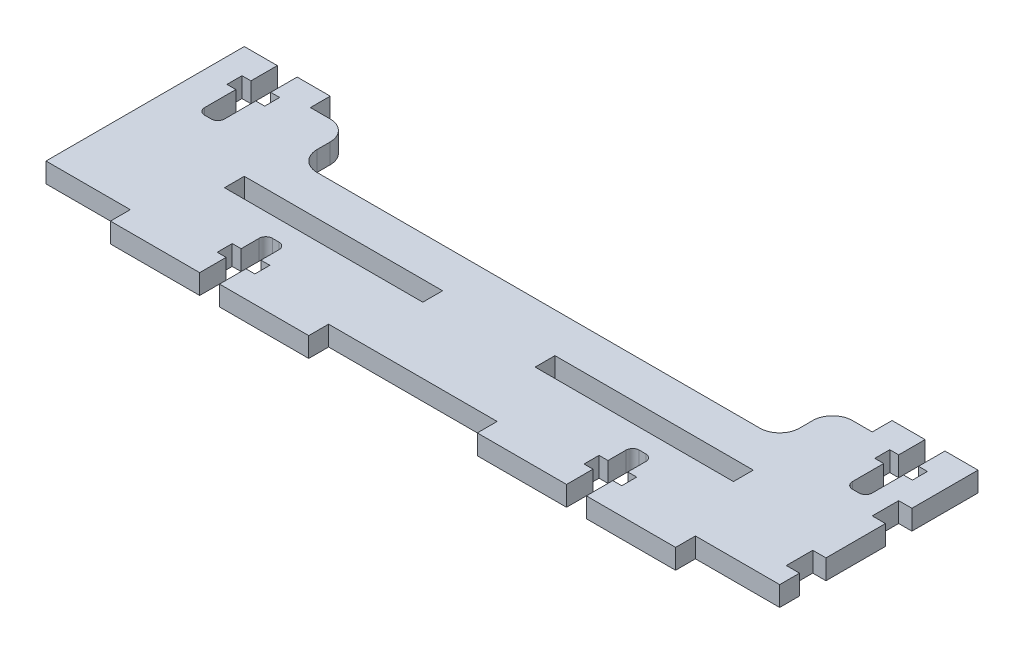
from build123d import *

# Parameters (mm, degrees)
SKETCH1_W               = 111
SKETCH1_H               = 30
BOSS_EXTRUDE1_DEPTH     = 1.5
SKETCH2_W               = 30
SKETCH2_H               = 3
BOSS_EXTRUDE2_DEPTH     = 1.5
CUT_EXTRUDE2_DEPTH      = 59.365229375
CUT_EXTRUDE2_DEPTH_BACK = 59.365229375
CUT_EXTRUDE3_DEPTH      = 59.365229375
CUT_EXTRUDE3_DEPTH_BACK = 59.365229375
SKETCH6_W               = 2
SKETCH6_H               = 4
CUT_EXTRUDE4_DEPTH      = 59.423026282
CUT_EXTRUDE4_DEPTH_BACK = 59.423026282
SKETCH7_W               = 30
SKETCH7_H               = 3
CUT_EXTRUDE5_DEPTH      = 59.365229375
CUT_EXTRUDE5_DEPTH_BACK = 59.365229375
SKETCH8_W               = 85
SKETCH8_H               = 3
CUT_EXTRUDE7_DEPTH      = 59.365229375
CUT_EXTRUDE7_DEPTH_BACK = 59.365229375
SKETCH10_W              = 73
SKETCH10_H              = 8
FILLET1_R               = 3
CUT_EXTRUDE6_DEPTH      = 59.365229375
CUT_EXTRUDE6_DEPTH_BACK = 59.365229375


with BuildPart() as part:
    # Sketch1 → Boss-Extrude1 (new, symmetric)
    with BuildSketch(Plane(origin=(0, 0, 0), x_dir=(1, 0, 0), z_dir=(0, 1, 0))):
        Rectangle(SKETCH1_W, SKETCH1_H)
    extrude(amount=BOSS_EXTRUDE1_DEPTH, both=True)

    # Sketch2 → Boss-Extrude2 (add, symmetric)
    with BuildSketch(Plane(origin=(0, 0, 0), x_dir=(1, 0, 0), z_dir=(0, 1, 0))):
        with Locations((-27.75, -16.5)):
            Rectangle(SKETCH2_W, SKETCH2_H)
        with Locations((27.75, -16.5)):
            Rectangle(SKETCH2_W, SKETCH2_H)
    extrude(amount=BOSS_EXTRUDE2_DEPTH, both=True)

    # Sketch5 → Cut-Extrude2 (cut, two sides: drawn at the far end of the back side and taken through both)
    with BuildSketch(Plane(origin=(0, 0, 0), x_dir=(1, 0, 0), z_dir=(0, 1, 0)).offset(-CUT_EXTRUDE2_DEPTH_BACK)):
        with BuildLine():
            Line((-29.25, -18), (-26.25, -18))
            Line((-26.25, -18), (-26.25, -14))
            Line((-26.25, -14), (-24.9, -14))
            Line((-24.9, -14), (-24.9, -11.73))
            Line((-24.9, -11.73), (-26.25, -11.73))
            Line((-26.25, -11.73), (-26.25, -9))
            ThreePointArc((-26.25, -9), (-26.542893219, -8.292893219), (-27.25, -8))
            Line((-27.25, -8), (-28.25, -8))
            ThreePointArc((-28.25, -8), (-28.957106781, -8.292893219), (-29.25, -9))
            Line((-29.25, -9), (-29.25, -11.73))
            Line((-29.25, -11.73), (-30.596948556, -11.73))
            Line((-30.596948556, -11.73), (-30.596948556, -14))
            Line((-30.596948556, -14), (-29.25, -14))
            Line((-29.25, -14), (-29.25, -18))
        make_face()
        with BuildLine():
            Line((26.25, -14), (24.9, -14))
            Line((24.9, -14), (24.9, -11.73))
            Line((24.9, -11.73), (26.25, -11.73))
            Line((26.25, -11.73), (26.25, -9))
            ThreePointArc((26.25, -9), (26.542893219, -8.292893219), (27.25, -8))
            Line((27.25, -8), (28.25, -8))
            ThreePointArc((28.25, -8), (28.957106781, -8.292893219), (29.25, -9))
            Line((29.25, -9), (29.25, -11.73))
            Line((29.25, -11.73), (30.596948556, -11.73))
            Line((30.596948556, -11.73), (30.596948556, -14))
            Line((30.596948556, -14), (29.25, -14))
            Line((29.25, -14), (29.25, -18))
            Line((29.25, -18), (26.25, -18))
            Line((26.25, -18), (26.25, -14))
        make_face()
    extrude(amount=CUT_EXTRUDE2_DEPTH + CUT_EXTRUDE2_DEPTH_BACK, mode=Mode.SUBTRACT)

    # Sketch6 → Cut-Extrude3 (cut, two sides: drawn at the far end of the back side and taken through both)
    with BuildSketch(Plane(origin=(0, 0, 0), x_dir=(1, 0, 0), z_dir=(0, 1, 0)).offset(-CUT_EXTRUDE3_DEPTH_BACK)):
        with Locations((54.5, -10)):
            Rectangle(SKETCH6_W, SKETCH6_H)
        with Locations((54.5, 3)):
            Rectangle(SKETCH6_W, SKETCH6_H)
    extrude(amount=CUT_EXTRUDE3_DEPTH + CUT_EXTRUDE3_DEPTH_BACK, mode=Mode.SUBTRACT)

    # Sketch7 → Cut-Extrude4 (cut, two sides: drawn at the far end of the back side and taken through both)
    with BuildSketch(Plane(origin=(0, 1.5, 0), x_dir=(1, 0, 0), z_dir=(0, 1, 0)).offset(-CUT_EXTRUDE4_DEPTH_BACK)):
        with Locations((-23.5, -3.5)):
            Rectangle(SKETCH7_W, SKETCH7_H)
        with Locations((23.5, -3.5)):
            Rectangle(SKETCH7_W, SKETCH7_H)
    extrude(amount=CUT_EXTRUDE4_DEPTH + CUT_EXTRUDE4_DEPTH_BACK, mode=Mode.SUBTRACT)

    # Sketch8 → Cut-Extrude5 (cut, two sides: drawn at the far end of the back side and taken through both)
    with BuildSketch(Plane(origin=(0, 0, 0), x_dir=(1, 0, 0), z_dir=(0, 1, 0)).offset(-CUT_EXTRUDE5_DEPTH_BACK)):
        with Locations((0, 13.5)):
            Rectangle(SKETCH8_W, SKETCH8_H)
    extrude(amount=CUT_EXTRUDE5_DEPTH + CUT_EXTRUDE5_DEPTH_BACK, mode=Mode.SUBTRACT)

    # Sketch10 → Cut-Extrude7 (cut, two sides: drawn at the far end of the back side and taken through both)
    with BuildSketch(Plane(origin=(0, 0, 0), x_dir=(1, 0, 0), z_dir=(0, 1, 0)).offset(-CUT_EXTRUDE7_DEPTH_BACK)):
        with Locations((0, 8)):
            Rectangle(SKETCH10_W, SKETCH10_H)
    extrude(amount=CUT_EXTRUDE7_DEPTH + CUT_EXTRUDE7_DEPTH_BACK, mode=Mode.SUBTRACT)

    # Fillet1
    fillet1_edges = [part.edges().sort_by_distance(p)[0] for p in [
        (-36.5, 0, -4),
        (-36.5, 0, -12),
        (36.5, 0, -12),
        (36.5, 0, -4),
    ]]
    fillet(fillet1_edges, radius=FILLET1_R)

    # Sketch9 → Cut-Extrude6 (cut, two sides: drawn at the far end of the back side and taken through both)
    with BuildSketch(Plane(origin=(0, 0, 0), x_dir=(1, 0, 0), z_dir=(0, 1, 0)).offset(-CUT_EXTRUDE6_DEPTH_BACK)):
        with BuildLine():
            Line((-50.5, 15), (-47.5, 15))
            Line((-47.5, 15), (-47.5, 11))
            Line((-47.5, 11), (-46.15, 11))
            Line((-46.15, 11), (-46.15, 8.73))
            Line((-46.15, 8.73), (-47.5, 8.73))
            Line((-47.5, 8.73), (-47.5, 4))
            ThreePointArc((-47.5, 4), (-47.792893219, 3.292893219), (-48.5, 3))
            Line((-48.5, 3), (-49.5, 3))
            ThreePointArc((-49.5, 3), (-50.207106781, 3.292893219), (-50.5, 4))
            Line((-50.5, 4), (-50.5, 8.73))
            Line((-50.5, 8.73), (-51.85, 8.73))
            Line((-51.85, 8.73), (-51.85, 11))
            Line((-51.85, 11), (-50.5, 11))
            Line((-50.5, 11), (-50.5, 15))
        make_face()
        with BuildLine():
            Line((47.5, 8.73), (47.5, 4))
            ThreePointArc((47.5, 4), (47.792893219, 3.292893219), (48.5, 3))
            Line((48.5, 3), (49.5, 3))
            ThreePointArc((49.5, 3), (50.207106781, 3.292893219), (50.5, 4))
            Line((50.5, 4), (50.5, 8.73))
            Line((50.5, 8.73), (51.85, 8.73))
            Line((51.85, 8.73), (51.85, 11))
            Line((51.85, 11), (50.5, 11))
            Line((50.5, 11), (50.5, 15))
            Line((50.5, 15), (47.5, 15))
            Line((47.5, 15), (47.5, 11))
            Line((47.5, 11), (46.15, 11))
            Line((46.15, 11), (46.15, 8.73))
            Line((46.15, 8.73), (47.5, 8.73))
        make_face()
    extrude(amount=CUT_EXTRUDE6_DEPTH + CUT_EXTRUDE6_DEPTH_BACK, mode=Mode.SUBTRACT)


solid = part.part
